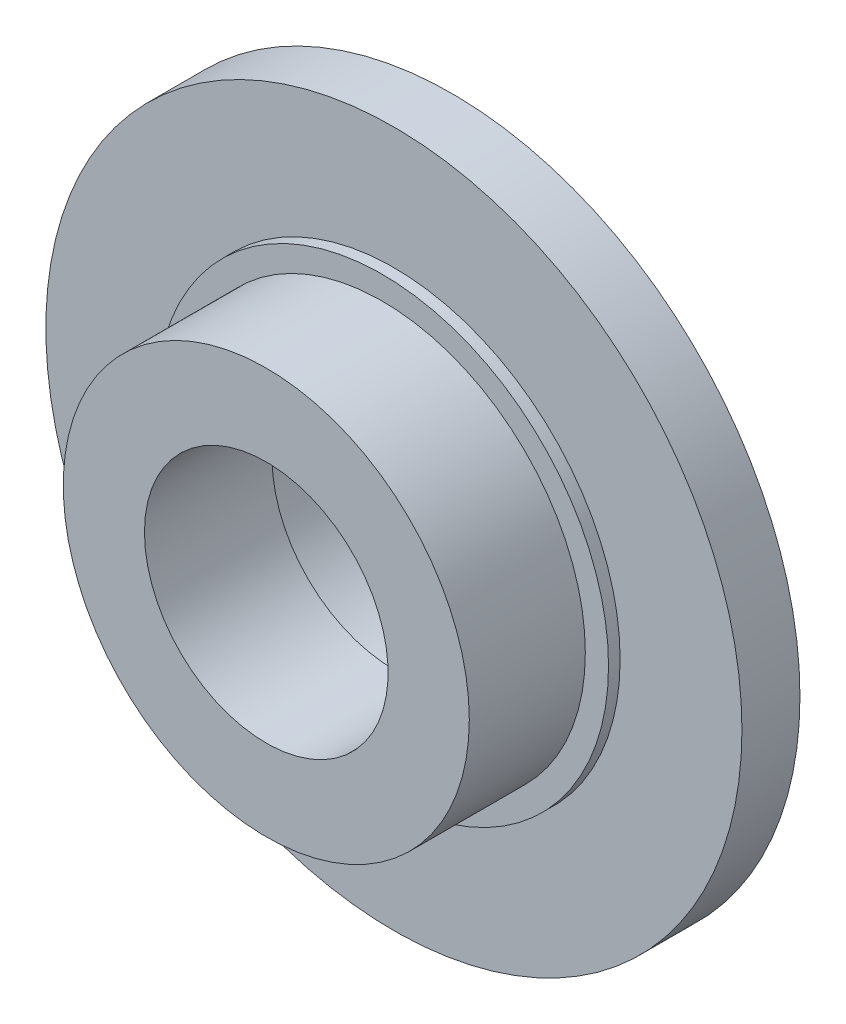
from build123d import *

# Parameters (mm, degrees)
SKETCH1_R               = 30
BOSS_EXTRUDE1_DEPTH     = 5
SKETCH2_R               = 19.5
BOSS_EXTRUDE2_DEPTH     = 1
SKETCH3_R               = 17.5
BOSS_EXTRUDE3_DEPTH     = 10
CUT_EXTRUDE1_DEPTH      = 4
CUT_EXTRUDE1_DEPTH_BACK = 4
CUT_EXTRUDE1_START      = -5
SKETCH5_R               = 2.05
SKETCH9_R               = 5.5
CUT_EXTRUDE5_DEPTH      = 4
SKETCH7_R               = 12.025
CUT_EXTRUDE3_DEPTH      = 5
SKETCH8_R               = 10.5
CUT_EXTRUDE4_DEPTH      = 44.829214002


with BuildPart() as part:
    # Sketch1 → Boss-Extrude1 (new body)
    with BuildSketch(Plane.XY):
        Circle(SKETCH1_R)
    extrude(amount=BOSS_EXTRUDE1_DEPTH)

    # Sketch2 → Boss-Extrude2 (add)
    with BuildSketch(Plane.XY.offset(5)):
        Circle(SKETCH2_R)
    extrude(amount=BOSS_EXTRUDE2_DEPTH)

    # Sketch3 → Boss-Extrude3 (add)
    with BuildSketch(Plane.XY.offset(6)):
        Circle(SKETCH3_R)
    extrude(amount=BOSS_EXTRUDE3_DEPTH)

    # Sketch5 → Cut-Extrude1 (cut, two sides: drawn at the far end of the back side and taken through both)
    with BuildSketch(Plane.XY.offset(5).offset(CUT_EXTRUDE1_START - CUT_EXTRUDE1_DEPTH_BACK)):
        with Locations((24.5, 0)):
            Circle(SKETCH5_R)
        with Locations((12.25, -21.217622393)):
            Circle(SKETCH5_R)
        with Locations((-12.25, -21.217622393)):
            Circle(SKETCH5_R)
        with Locations((-24.5, 0)):
            Circle(SKETCH5_R)
        with Locations((-12.25, 21.217622393)):
            Circle(SKETCH5_R)
        with Locations((12.25, 21.217622393)):
            Circle(SKETCH5_R)
    extrude(amount=CUT_EXTRUDE1_DEPTH + CUT_EXTRUDE1_DEPTH_BACK, mode=Mode.SUBTRACT)

    # Sketch9 → Cut-Extrude5 (cut)
    with BuildSketch(Plane(origin=(0, 0, 0), x_dir=(-1, 0, 0), z_dir=(0, 0, -1))):
        Circle(SKETCH9_R)
    extrude(amount=-CUT_EXTRUDE5_DEPTH, mode=Mode.SUBTRACT)

    # Sketch7 → Cut-Extrude3 (cut)
    with BuildSketch(Plane(origin=(0, 0, 0), x_dir=(-1, 0, 0), z_dir=(0, 0, -1))):
        Circle(SKETCH7_R)
    extrude(amount=-CUT_EXTRUDE3_DEPTH, mode=Mode.SUBTRACT)

    # Sketch8 → Cut-Extrude4 (cut, through all)
    with BuildSketch(Plane(origin=(0, 0, 5), x_dir=(-1, 0, 0), z_dir=(0, 0, -1))):
        Circle(SKETCH8_R)
    extrude(amount=-CUT_EXTRUDE4_DEPTH, mode=Mode.SUBTRACT)


solid = part.part
